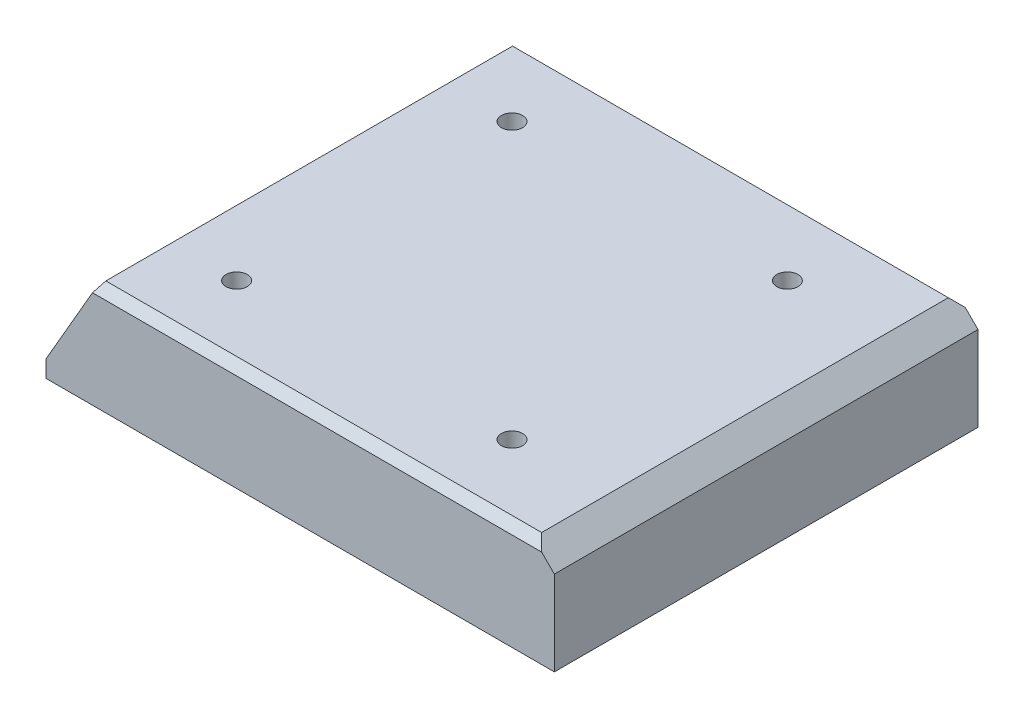
from build123d import *

# Parameters (mm, degrees)
BOSS_EXTRUDE1_DEPTH = 50
SKETCH2_R           = 2.5
CUT_EXTRUDE1_DEPTH  = 83.006097334
SKETCH3_R           = 1.5
CUT_EXTRUDE2_DEPTH  = 12.4
CHAMFER1_SIZE       = 2


with BuildPart() as part:
    # Sketch1 → Boss-Extrude1 (new, symmetric)
    with BuildSketch(Plane.XY):
        Polygon((-60, 0), (60, 0), (60, 20), (55, 25), (-47.875644347, 25), (-60, 4), align=None)
    extrude(amount=BOSS_EXTRUDE1_DEPTH, both=True)

    # Sketch2 → Cut-Extrude1 (cut, through all)
    with BuildSketch(Plane(origin=(0, 25, 0), x_dir=(1, 0, 0), z_dir=(0, 1, 0))):
        with Locations(Location((-32.5, 32.5, 0), (0, 0, 180))):
            Circle(SKETCH2_R)
        with Locations((-32.5, -32.5)):
            Circle(SKETCH2_R)
    cut_extrude1 = extrude(amount=-CUT_EXTRUDE1_DEPTH, mode=Mode.SUBTRACT)

    # Mirror1: Cut-Extrude1 across plane
    add(cut_extrude1.mirror(Plane(origin=(0, 0, 0), x_dir=(0, 0, 1), z_dir=(1, 0, 0))), mode=Mode.SUBTRACT)

    # Sketch3 → Cut-Extrude2 (cut)
    with BuildSketch(Plane(origin=(-46.732050808, 26.980762114, 0), x_dir=(0, 0, 1), z_dir=(-0.8660254037844384, 0.5000000000000007, 0))):
        with Locations(Location((-25, -14.411542732, 0), (0, 0, 270))):
            Circle(SKETCH3_R)
        with Locations(Location((27, -14.411542732, 0), (0, 0, 270))):
            Circle(SKETCH3_R)
    extrude(amount=-CUT_EXTRUDE2_DEPTH, mode=Mode.SUBTRACT)

    # Chamfer1
    chamfer1_edges = [part.edges().sort_by_distance(p)[0] for p in [
        (3.562177826, 25, 50),
        (3.562177826, 25, -50),
    ]]
    chamfer(chamfer1_edges, length=CHAMFER1_SIZE)


solid = part.part
